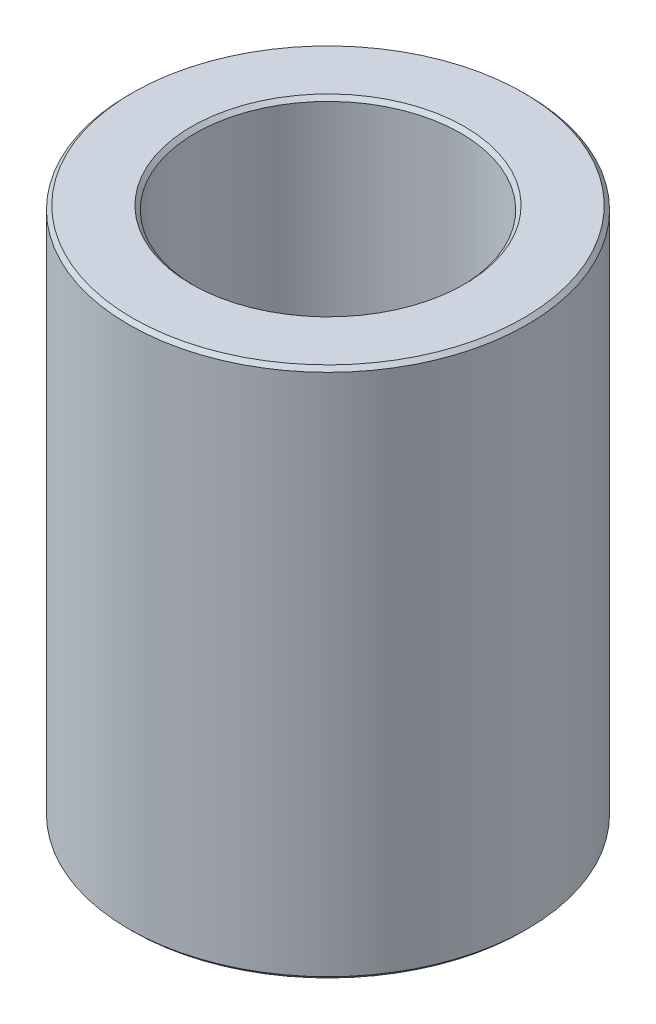
from build123d import *

# Parameters (mm, degrees)
AUFSATZ_LINEAR_AUSTRAGEN1_DEPTH      = 14
AUFSATZ_LINEAR_AUSTRAGEN1_DEPTH_BACK = 14
SKIZZE1_R                            = 10.5
SKIZZE1_R_2                          = 7
FASE1_SIZE                           = 0.2


with BuildPart() as part:
    # Skizze1 → Aufsatz-Linear austragen1 (new, two sides: drawn at the far end of the back side and taken through both)
    with BuildSketch(Plane(origin=(0, 0, 0), x_dir=(1, 0, 0), z_dir=(0, 1, 0)).offset(-AUFSATZ_LINEAR_AUSTRAGEN1_DEPTH_BACK)):
        Circle(SKIZZE1_R)
        Circle(SKIZZE1_R_2, mode=Mode.SUBTRACT)
    extrude(amount=AUFSATZ_LINEAR_AUSTRAGEN1_DEPTH + AUFSATZ_LINEAR_AUSTRAGEN1_DEPTH_BACK)

    # Fase1
    fase1_edges = [part.edges().sort_by_distance(p)[0] for p in [
        (-7, -14, 0),
        (-10.5, -14, 0),
        (-10.5, 14, 0),
        (-7, 14, 0),
    ]]
    chamfer(fase1_edges, length=FASE1_SIZE)


solid = part.part
